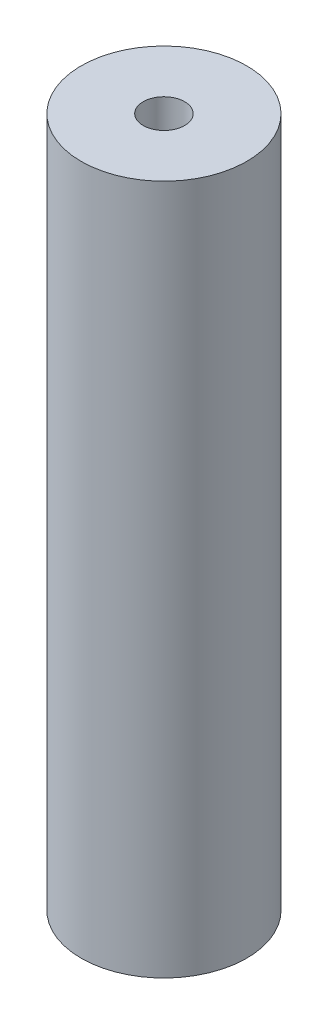
from build123d import *

# Parameters (mm, degrees)
SKETCH1_R                       = 6
BOSS_EXTRUDE1_DEPTH             = 50
F_32_0_116_DIAMETER_HOLE1_D     = 3.000000096
F_32_0_116_DIAMETER_HOLE1_DEPTH = 10
F_32_0_116_DIAMETER_HOLE1_TIP   = 0.901290957


with BuildPart() as part:
    # Sketch1 → Boss-Extrude1 (new body)
    with BuildSketch(Plane(origin=(0, 0, 0), x_dir=(1, 0, 0), z_dir=(0, 1, 0))):
        with Locations(Location((0, 0, 0), (0, 0, 270))):
            Circle(SKETCH1_R)
    extrude(amount=BOSS_EXTRUDE1_DEPTH)

    # #32 (0.116) Diameter Hole1
    with Locations(Plane(origin=(0, 50, 0), x_dir=(1, 0, 0), z_dir=(0, 1, 0))):
        with Locations((0, 0)):
            Hole(F_32_0_116_DIAMETER_HOLE1_D / 2, depth=F_32_0_116_DIAMETER_HOLE1_DEPTH)
            with Locations((0, 0, -(F_32_0_116_DIAMETER_HOLE1_DEPTH + F_32_0_116_DIAMETER_HOLE1_TIP / 2))):  # 118° drill point
                Cone(0, F_32_0_116_DIAMETER_HOLE1_D / 2, F_32_0_116_DIAMETER_HOLE1_TIP, mode=Mode.SUBTRACT)


solid = part.part
